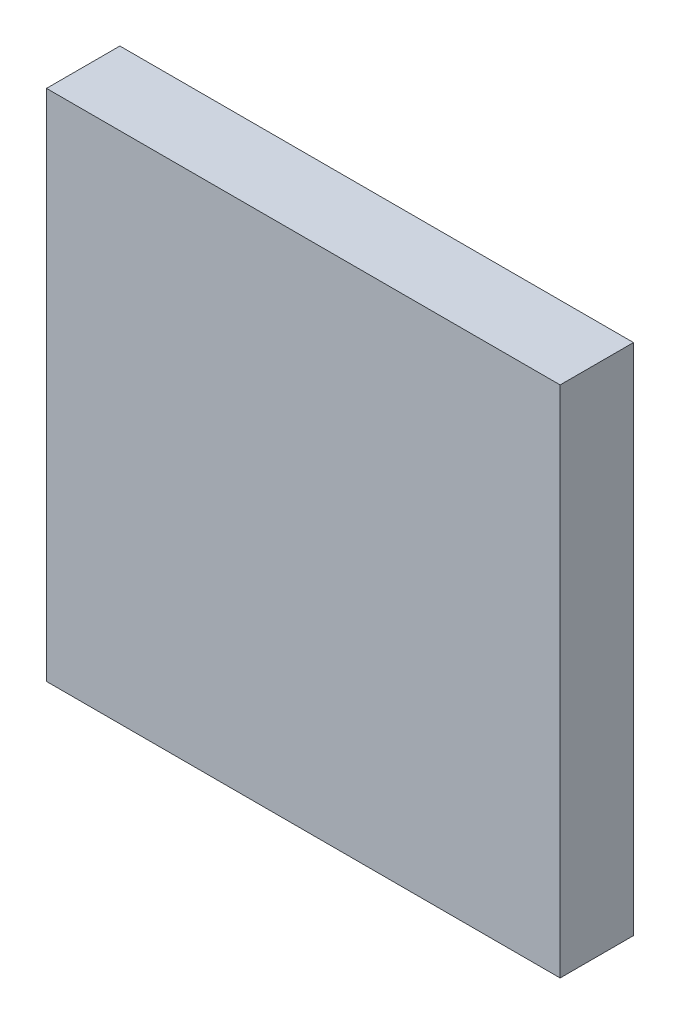
from build123d import *

# Parameters (mm, degrees)
SKETCH1_W           = 35
SKETCH1_H           = 35
BOSS_EXTRUDE1_DEPTH = 5


with BuildPart() as part:
    # Sketch1 → Boss-Extrude1 (new body)
    with BuildSketch(Plane.XY):
        with Locations((-2.113792049, -1.286739239)):
            Rectangle(SKETCH1_W, SKETCH1_H)
    extrude(amount=BOSS_EXTRUDE1_DEPTH)


solid = part.part
